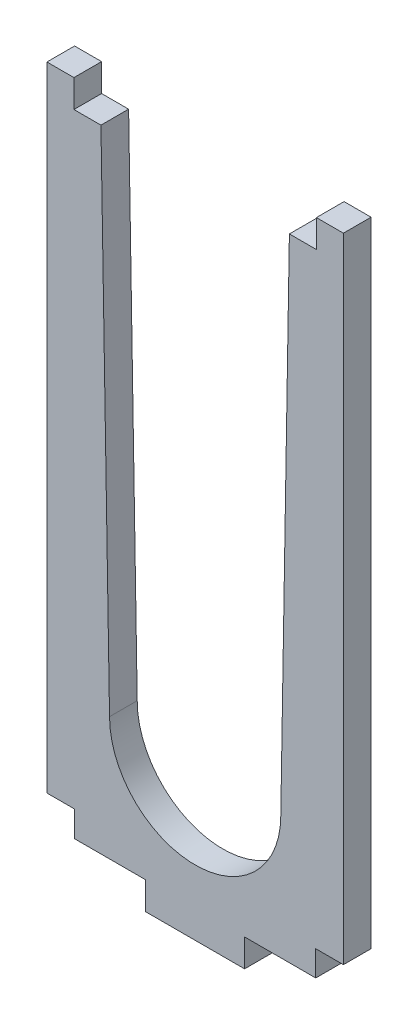
from build123d import *

# Parameters (mm, degrees)
SKETCH8_W           = 57.15
SKETCH8_H           = 127
BOSS_EXTRUDE3_DEPTH = 5.334
SKETCH9_R           = 16.505180298
CUT_EXTRUDE4_DEPTH  = 140.368483008
SKETCH12_W          = 19.05
SKETCH12_H          = 5.334
CUT_EXTRUDE8_DEPTH  = 5.334
SKETCH14_W          = 10.414
SKETCH14_H          = 5.334
BOSS_EXTRUDE4_DEPTH = 5.334
SKETCH15_W          = 5.207
SKETCH15_H          = 5.334
CUT_EXTRUDE9_DEPTH  = 5.334
SKETCH16_W          = 5.334
SKETCH16_H          = 4.5085
CUT_EXTRUDE10_DEPTH = 5.334
SKETCH19_W          = 4.7625
SKETCH19_H          = 4.5085
CUT_EXTRUDE12_DEPTH = 5.334
SKETCH20_W          = 5.334
SKETCH20_H          = 4.5085
CUT_EXTRUDE13_DEPTH = 145.225834933
SKETCH21_W          = 5.335765508
SKETCH21_H          = 0.4572
SKETCH21_W_2        = 5.334
SKETCH21_H_2        = 0.381
CUT_EXTRUDE14_DEPTH = 145.245837417


with BuildPart() as part:
    # Sketch8 → Boss-Extrude3 (new body)
    with BuildSketch(Plane.XY):
        with Locations((28.575, 63.5)):
            Rectangle(SKETCH8_W, SKETCH8_H)
    extrude(amount=BOSS_EXTRUDE3_DEPTH)

    # Sketch9 → Cut-Extrude4 (cut, through all)
    with BuildSketch(Plane.XY.offset(5.334)):
        with BuildLine():
            Line((46.736, 127), (10.414, 127))
            Line((10.414, 127), (12.069819702, 29.083))
            ThreePointArc((12.069819702, 29.083), (28.575, 45.588180298), (45.080180298, 29.083))
            Line((45.080180298, 29.083), (46.736, 127))
        make_face()
        with Locations((28.575, 29.083)):
            Circle(SKETCH9_R)
    extrude(amount=-CUT_EXTRUDE4_DEPTH, mode=Mode.SUBTRACT)

    # Sketch12 → Cut-Extrude8 (cut)
    with BuildSketch(Plane(origin=(0, 0, 0), x_dir=(-1, 0, 0), z_dir=(0, -1, 0))):
        with Locations((-47.625, -2.667)):
            Rectangle(SKETCH12_W, SKETCH12_H)
        with Locations((-9.525, -2.667)):
            Rectangle(SKETCH12_W, SKETCH12_H)
    extrude(amount=-CUT_EXTRUDE8_DEPTH, mode=Mode.SUBTRACT)

    # Sketch14 → Boss-Extrude4 (add)
    with BuildSketch(Plane(origin=(0, 127, 0), x_dir=(1, 0, 0), z_dir=(0, 1, 0))):
        with Locations((51.943, -2.667)):
            Rectangle(SKETCH14_W, SKETCH14_H)
        with Locations((5.207, -2.667)):
            Rectangle(SKETCH14_W, SKETCH14_H)
    extrude(amount=BOSS_EXTRUDE4_DEPTH)

    # Sketch15 → Cut-Extrude9 (cut)
    with BuildSketch(Plane(origin=(0, 132.334, 0), x_dir=(1, 0, 0), z_dir=(0, 1, 0))):
        with Locations((7.8105, -2.667)):
            Rectangle(SKETCH15_W, SKETCH15_H)
        with Locations((49.3395, -2.667)):
            Rectangle(SKETCH15_W, SKETCH15_H)
    extrude(amount=-CUT_EXTRUDE9_DEPTH, mode=Mode.SUBTRACT)

    # Sketch16 → Cut-Extrude10 (cut)
    with BuildSketch(Plane.ZY):
        with Locations((2.667, 7.58825)):
            Rectangle(SKETCH16_W, SKETCH16_H)
    extrude(amount=-CUT_EXTRUDE10_DEPTH, mode=Mode.SUBTRACT)

    # Sketch19 → Cut-Extrude12 (cut)
    with BuildSketch(Plane(origin=(57.15, 0, 0), x_dir=(0, 0, -1), z_dir=(1, 0, 0))):
        with Locations((-2.38125, 7.58825)):
            Rectangle(SKETCH19_W, SKETCH19_H)
    extrude(amount=-CUT_EXTRUDE12_DEPTH, mode=Mode.SUBTRACT)

    # Sketch20 → Cut-Extrude13 (cut, through all)
    with BuildSketch(Plane(origin=(0, 0, 4.7625), x_dir=(-1, 0, 0), z_dir=(0, 0, -1))):
        with Locations((-54.483, 7.58825)):
            Rectangle(SKETCH20_W, SKETCH20_H)
    extrude(amount=-CUT_EXTRUDE13_DEPTH, mode=Mode.SUBTRACT)

    # Sketch21 → Cut-Extrude14 (cut, through all)
    with BuildSketch(Plane.XY.offset(5.334)):
        with Locations((2.667882754, 10.0711)):
            Rectangle(SKETCH21_W, SKETCH21_H)
        with Locations((54.483, 10.033)):
            Rectangle(SKETCH21_W_2, SKETCH21_H_2)
    extrude(amount=-CUT_EXTRUDE14_DEPTH, mode=Mode.SUBTRACT)


solid = part.part
